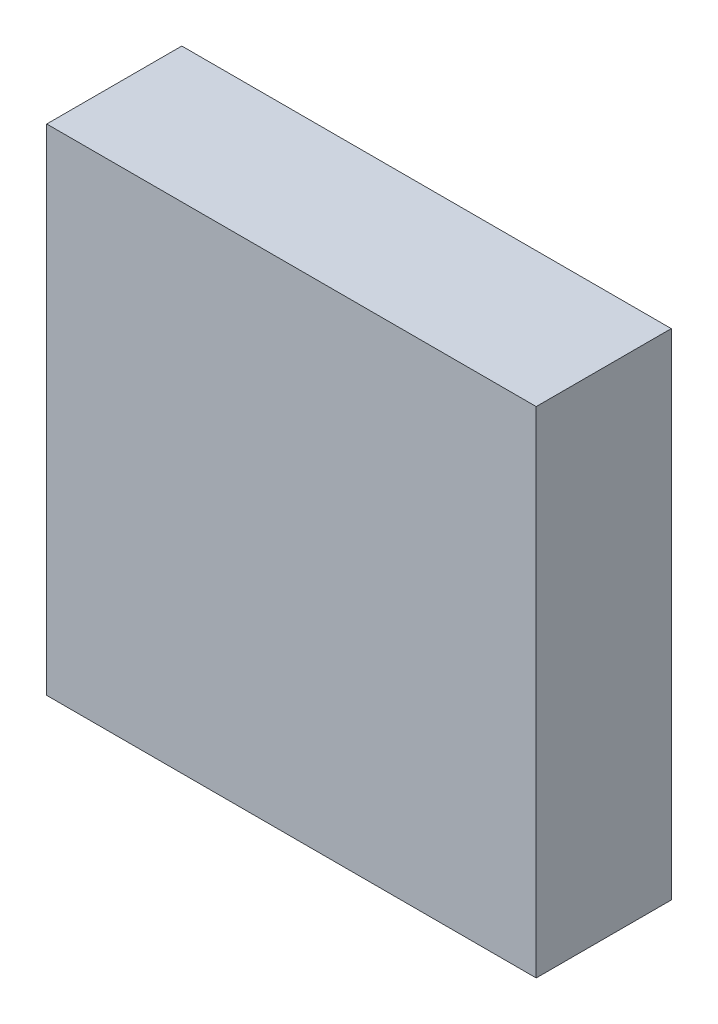
from build123d import *

# Parameters (mm, degrees)
SKETCH1_W               = 78.0635
SKETCH1_H               = 78.927
COMPONENT_OUTLINE_DEPTH = 21.54


with BuildPart() as part:
    # Sketch1 → Component_Outline (new body)
    with BuildSketch(Plane.XY):
        with Locations((-0.03175, 0)):
            Rectangle(SKETCH1_W, SKETCH1_H)
    extrude(amount=COMPONENT_OUTLINE_DEPTH)


solid = part.part
